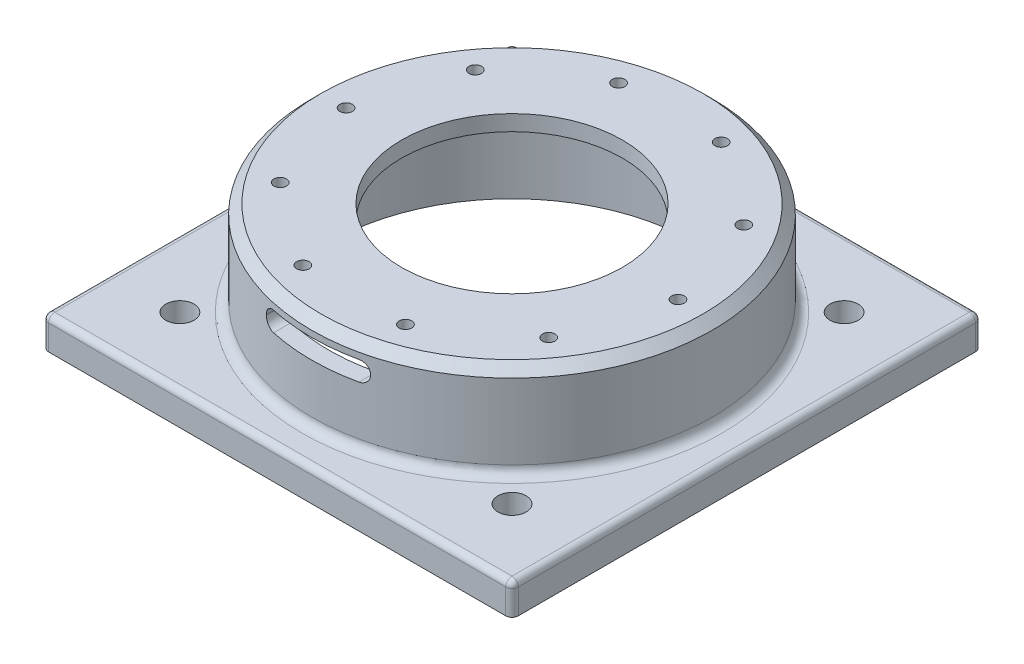
from build123d import *

# Parameters (mm, degrees)
SKETCH_1_W          = 150
SKETCH_1_H          = 150
SKETCH_1_R          = 4.5
EXTRUDE_1_DEPTH     = 10
FILLET_1_R          = 2
FILLET_2_R          = 2
SKETCH_4_R          = 64
EXTRUDE_4_DEPTH     = 30
FILLET_5_R          = 3
SKETCH_11_R         = 35.25
CUT_EXTRUDE_2_DEPTH = 114.357840488
SKETCH_10_R         = 58.5
CUT_EXTRUDE_3_DEPTH = 35
SKETCH_12_R         = 2
CUT_EXTRUDE_4_DEPTH = 114.357840488
CHAMFER_2_SIZE      = 3
SKETCH_14_W         = 33.25
SKETCH_14_H         = 6.25
CUT_EXTRUDE_5_DEPTH = 9
FILLET_7_R          = 3


with BuildPart() as part:
    # Эскиз1 → Бобышка-Вытянуть1 (new body)
    with BuildSketch(Plane(origin=(0, 0, 0), x_dir=(1, 0, 0), z_dir=(0, 1, 0))):
        Rectangle(SKETCH_1_W, SKETCH_1_H)
        with Locations(Location((53.033008589, 53.033008589, 0), (0, 0, 270))):
            Circle(SKETCH_1_R, mode=Mode.SUBTRACT)
        with Locations(Location((53.033008589, -53.033008589, 0), (0, 0, 270))):
            Circle(SKETCH_1_R, mode=Mode.SUBTRACT)
        with Locations(Location((-53.033008589, -53.033008589, 0), (0, 0, 270))):
            Circle(SKETCH_1_R, mode=Mode.SUBTRACT)
        with Locations(Location((-53.033008589, 53.033008589, 0), (0, 0, 270))):
            Circle(SKETCH_1_R, mode=Mode.SUBTRACT)
    extrude(amount=EXTRUDE_1_DEPTH)

    # Скругление1
    fillet_1_edges = [part.edges().sort_by_distance(p)[0] for p in [
        (-75, 5, -75),
        (75, 5, -75),
        (75, 5, 75),
        (-75, 5, 75),
    ]]
    fillet(fillet_1_edges, radius=FILLET_1_R)

    # Скругление2
    fillet_2_edges = [part.edges().sort_by_distance(p)[0] for p in [
        (-75, 10, 0),
        (0, 10, -75),
        (0, 10, 75),
        (75, 10, 0),
        (74.414213562, 10, 74.414213562),
        (-74.414213562, 10, 74.414213562),
        (74.414213562, 10, -74.414213562),
        (-74.414213562, 10, -74.414213562),
    ]]
    fillet(fillet_2_edges, radius=FILLET_2_R)

    # Эскиз4 → Бобышка-Вытянуть4 (add)
    with BuildSketch(Plane(origin=(0, 10, 0), x_dir=(1, 0, 0), z_dir=(0, 1, 0))):
        with Locations(Location((0, 0, 0), (0, 0, 270))):
            Circle(SKETCH_4_R)
    extrude(amount=EXTRUDE_4_DEPTH)

    # Скругление5
    fillet_5_edges = [part.edges().sort_by_distance(p)[0] for p in [
        (0, 10, -64),
    ]]
    fillet(fillet_5_edges, radius=FILLET_5_R)

    # Эскиз11 → Вырез-Вытянуть2 (cut, through all)
    with BuildSketch(Plane(origin=(0, 40, 0), x_dir=(1, 0, 0), z_dir=(0, 1, 0))):
        with Locations(Location((0, 0, 0), (0, 0, 270))):
            Circle(SKETCH_11_R)
    extrude(amount=-CUT_EXTRUDE_2_DEPTH, mode=Mode.SUBTRACT)

    # Эскиз10 → Вырез-Вытянуть3 (cut)
    with BuildSketch(Plane.XZ):
        with Locations(Location((0, 0, 0), (0, 0, 270))):
            Circle(SKETCH_10_R)
    extrude(amount=-CUT_EXTRUDE_3_DEPTH, mode=Mode.SUBTRACT)

    # Эскиз12 → Вырез-Вытянуть4 (cut, through all)
    with BuildSketch(Plane(origin=(0, 40, 0), x_dir=(1, 0, 0), z_dir=(0, 1, 0))):
        with Locations(Location((-53, 0, 0), (0, 0, 270))):
            Circle(SKETCH_12_R)
        with Locations(Location((-42.877900702, 31.152618372, 0), (0, 0, 270))):
            Circle(SKETCH_12_R)
        with Locations(Location((-16.377900702, 50.405995364, 0), (0, 0, 270))):
            Circle(SKETCH_12_R)
        with Locations(Location((16.377900702, 50.405995364, 0), (0, 0, 270))):
            Circle(SKETCH_12_R)
        with Locations(Location((42.877900702, 31.152618372, 0), (0, 0, 270))):
            Circle(SKETCH_12_R)
        with Locations(Location((53, 0, 0), (0, 0, 270))):
            Circle(SKETCH_12_R)
        with Locations(Location((42.877900702, -31.152618372, 0), (0, 0, 270))):
            Circle(SKETCH_12_R)
        with Locations(Location((16.377900702, -50.405995364, 0), (0, 0, 270))):
            Circle(SKETCH_12_R)
        with Locations(Location((-16.377900702, -50.405995364, 0), (0, 0, 270))):
            Circle(SKETCH_12_R)
        with Locations(Location((-42.877900702, -31.152618372, 0), (0, 0, 270))):
            Circle(SKETCH_12_R)
    extrude(amount=-CUT_EXTRUDE_4_DEPTH, mode=Mode.SUBTRACT)

    # Фаска2
    chamfer_2_edges = [part.edges().sort_by_distance(p)[0] for p in [
        (0, 40, -64),
    ]]
    chamfer(chamfer_2_edges, length=CHAMFER_2_SIZE)

    # Эскиз14 → Вырез-Вытянуть5 (cut)
    with BuildSketch(Plane.XY.offset(64)):
        with Locations((0, 31.875)):
            Rectangle(SKETCH_14_W, SKETCH_14_H)
    extrude(amount=-CUT_EXTRUDE_5_DEPTH, mode=Mode.SUBTRACT)

    # Скругление7
    fillet_7_edges = [part.edges().sort_by_distance(p)[0] for p in [
        (-16.625, 28.75, 58.945474725),
        (-16.625, 35, 58.945474725),
        (16.625, 35, 58.945474725),
        (16.625, 28.75, 58.945474725),
    ]]
    fillet(fillet_7_edges, radius=FILLET_7_R)


solid = part.part
